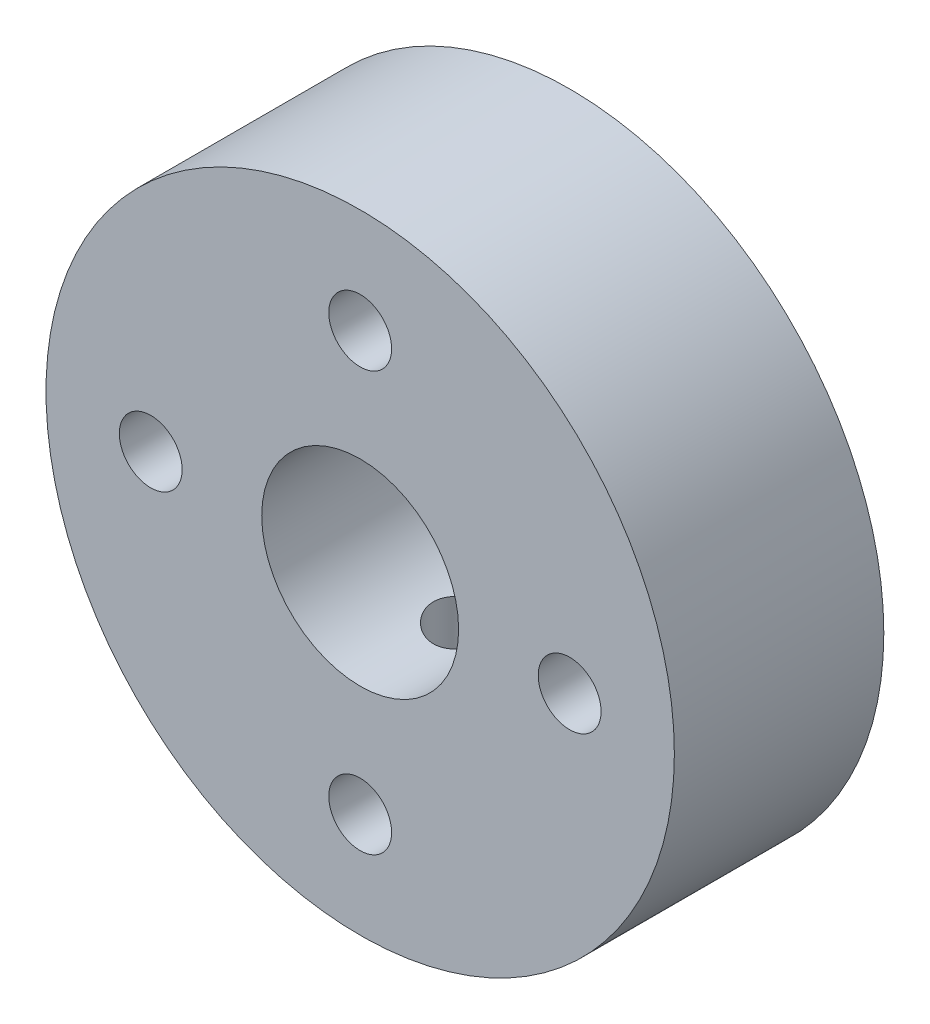
from build123d import *

# Parameters (mm, degrees)
SKETCH1_R           = 15
SKETCH1_R_2         = 1.5
SKETCH1_R_3         = 4.7
BOSS_EXTRUDE2_DEPTH = 10
SKETCH2_R           = 1.5
CUT_EXTRUDE1_DEPTH  = 35


with BuildPart() as part:
    # Sketch1 → Boss-Extrude2 (new body)
    with BuildSketch(Plane.XY):
        Circle(SKETCH1_R)
        with Locations((0, 10)):
            Circle(SKETCH1_R_2, mode=Mode.SUBTRACT)
        Circle(SKETCH1_R_3, mode=Mode.SUBTRACT)
        with Locations((10, 0)):
            Circle(SKETCH1_R_2, mode=Mode.SUBTRACT)
        with Locations((0, -10)):
            Circle(SKETCH1_R_2, mode=Mode.SUBTRACT)
        with Locations((-10, 0)):
            Circle(SKETCH1_R_2, mode=Mode.SUBTRACT)
    extrude(amount=BOSS_EXTRUDE2_DEPTH)

    # Sketch2 → Cut-Extrude1 (cut)
    with BuildSketch(Plane(origin=(0, 0, 0), x_dir=(1, 0, 0), z_dir=(0, 1, 0))):
        with Locations(Location((0, -5, 0), (0, 0, 270))):
            Circle(SKETCH2_R)
    extrude(amount=-CUT_EXTRUDE1_DEPTH, mode=Mode.SUBTRACT)


solid = part.part
